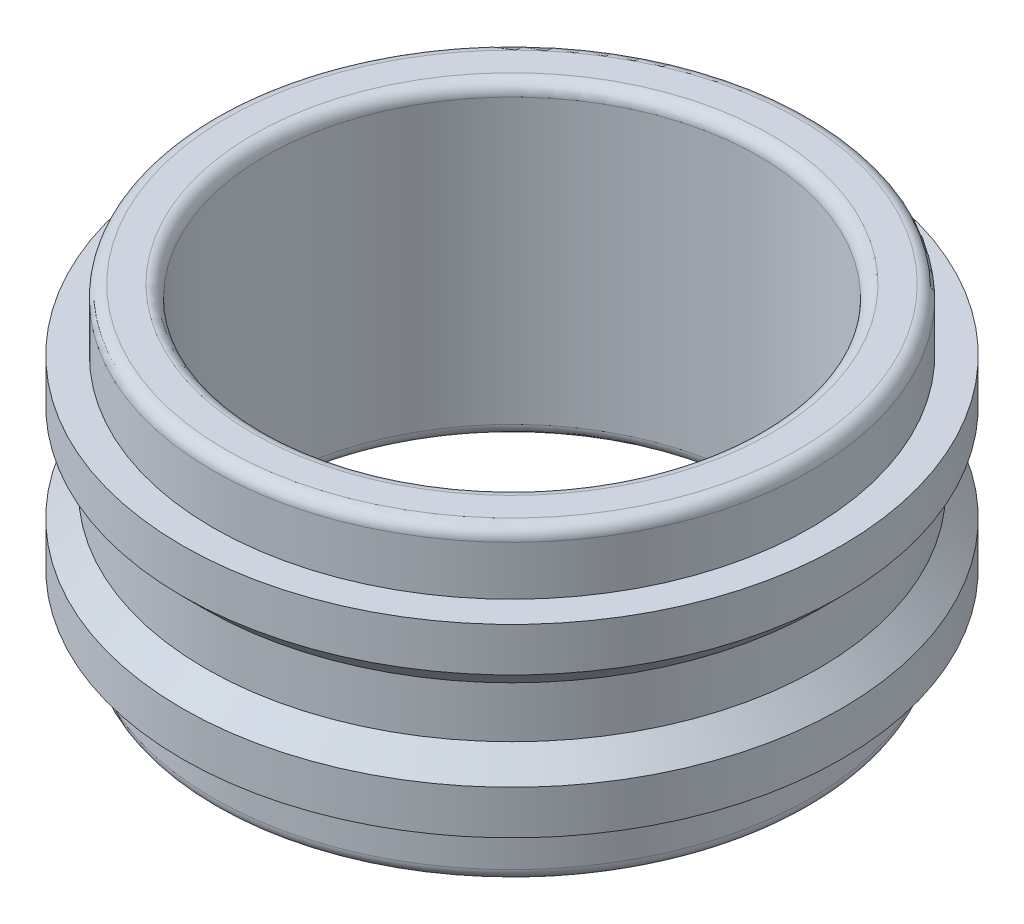
from build123d import *

# Parameters (mm, degrees)
IZIM1_R                     = 5.35
IZIM1_R_2                   = 4
Y_KSEKLIK_EKSTR_ZYON1_DEPTH = 5
KES_EKSTR_ZYON1_START       = -1
IZIM4_R                     = 5.35
IZIM4_R_2                   = 4.85
KES_EKSTR_ZYON1_DEPTH       = 1
L_O_ALTMA1_COUNT            = 2
L_O_ALTMA1_PITCH            = 4
RADYUS1_R                   = 0.2


with BuildPart() as part:
    # Çizim1 → Yükseklik-Ekstrüzyon1 (new body)
    with BuildSketch(Plane(origin=(0, 0, 0), x_dir=(1, 0, 0), z_dir=(0, 1, 0))):
        with Locations(Location((0, 0, 0), (0, 0, 270))):
            Circle(IZIM1_R)
        with Locations(Location((0, 0, 0), (0, 0, 270))):
            Circle(IZIM1_R_2, mode=Mode.SUBTRACT)
    extrude(amount=Y_KSEKLIK_EKSTR_ZYON1_DEPTH)

    # Çizim4 → Kes-Ekstrüzyon1 (cut)
    with BuildSketch(Plane(origin=(0, 5, 0), x_dir=(1, 0, 0), z_dir=(0, 1, 0)).offset(KES_EKSTR_ZYON1_START)):
        with Locations(Location((0, 0, 0), (0, 0, 270))):
            Circle(IZIM4_R)
        with Locations(Location((0, 0, 0), (0, 0, 270))):
            Circle(IZIM4_R_2, mode=Mode.SUBTRACT)
    kes_ekstr_zyon1 = extrude(amount=KES_EKSTR_ZYON1_DEPTH, mode=Mode.SUBTRACT)

    # LÇoğaltma1: Kes-Ekstrüzyon1 ×2
    with Locations(*[(0, -i * L_O_ALTMA1_PITCH, 0) for i in range(1, L_O_ALTMA1_COUNT)]):
        add(kes_ekstr_zyon1, mode=Mode.SUBTRACT)

    # Çizim6 → Kes-Döndür1 (revolve, cut)
    with BuildSketch(Plane.XY, mode=Mode.PRIVATE) as kes_d_nd_r1_sk:
        Polygon((-5.560786438, 3.5), (-4.975, 2.914213562), (-4.975, 2.085786438), (-5.560786438, 1.5), align=None)
    revolve(kes_d_nd_r1_sk.sketch.rotate(Axis((0, 0, 0), (0, 1, 0)), 270), axis=Axis((0, 0, 0), (0, 1, 0)), mode=Mode.SUBTRACT)

    # Radyus1
    radyus1_edges = [part.edges().sort_by_distance(p)[0] for p in [
        (0, 5, -4.85),
        (0, 0, -4.85),
        (0, 0, -4),
        (0, 5, -4),
    ]]
    fillet(radyus1_edges, radius=RADYUS1_R)


solid = part.part
